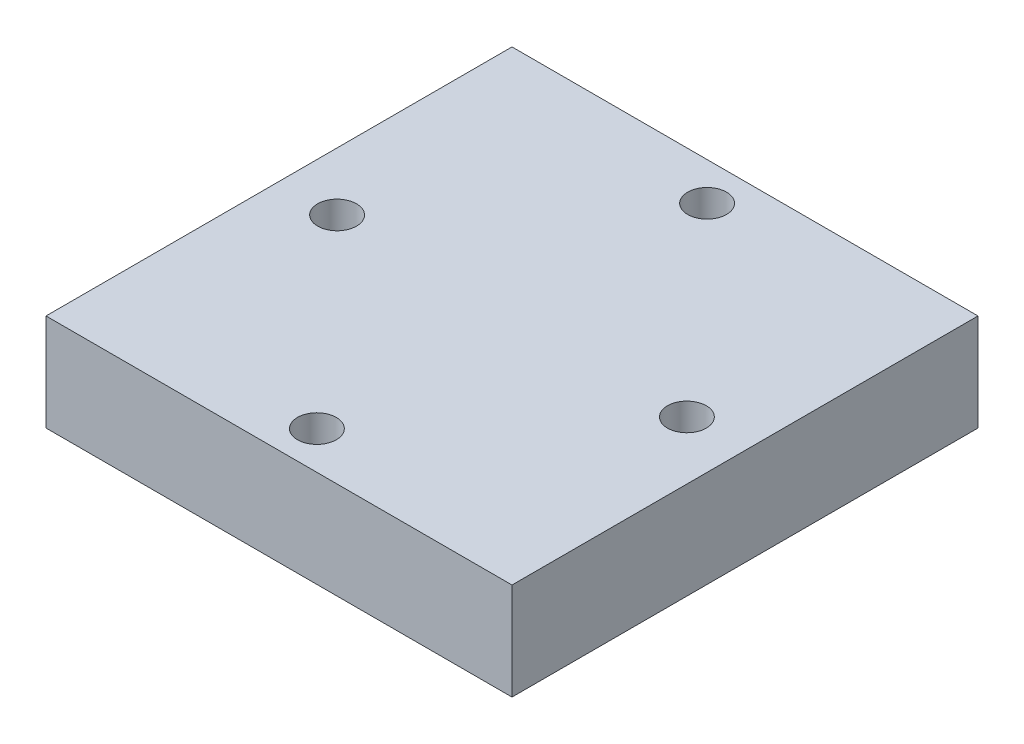
from build123d import *

# Parameters (mm, degrees)
SKETCH1_W           = 76.2
SKETCH1_H           = 76.2
BOSS_EXTRUDE1_DEPTH = 15.875
SKETCH2_R           = 3.175
CUT_EXTRUDE1_DEPTH  = 109.92610167
SKETCH2_3_R         = 3.175
CUT_EXTRUDE2_DEPTH  = 109.92610167


with BuildPart() as part:
    # Sketch1 → Boss-Extrude1 (new body)
    with BuildSketch(Plane(origin=(0, 0, 0), x_dir=(1, 0, 0), z_dir=(0, 1, 0))):
        with Locations((38.1, 38.1)):
            Rectangle(SKETCH1_W, SKETCH1_H)
    extrude(amount=BOSS_EXTRUDE1_DEPTH)

    # Sketch2 → Cut-Extrude1 (cut, through all)
    with BuildSketch(Plane(origin=(0, 15.875, 0), x_dir=(1, 0, 0), z_dir=(0, 1, 0))):
        with Locations((38.1, 70.00228824)):
            Circle(SKETCH2_R)
        with Locations((38.1, 6.19771176)):
            Circle(SKETCH2_R)
    extrude(amount=-CUT_EXTRUDE1_DEPTH, mode=Mode.SUBTRACT)

    # Sketch2<3> → Cut-Extrude2 (cut, through all)
    with BuildSketch(Plane(origin=(0, 15.875, 0), x_dir=(1, 0, 0), z_dir=(0, 1, 0))):
        with Locations((9.4996, 38.1)):
            Circle(SKETCH2_3_R)
        with Locations((66.7004, 38.1)):
            Circle(SKETCH2_3_R)
    extrude(amount=-CUT_EXTRUDE2_DEPTH, mode=Mode.SUBTRACT)


solid = part.part
